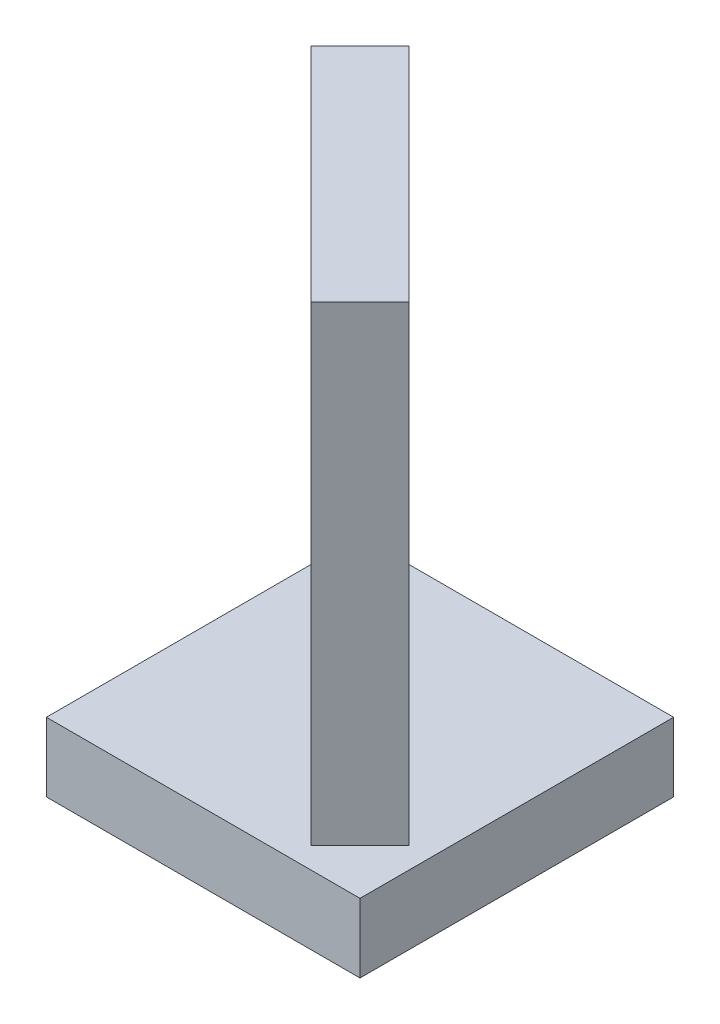
from build123d import *

# Parameters (mm, degrees)
SKETCH1_W           = 25.4
SKETCH1_H           = 25.4
BOSS_EXTRUDE1_DEPTH = 5.588
BOSS_EXTRUDE2_DEPTH = 38.1


with BuildPart() as part:
    # Sketch1 → Boss-Extrude1 (new body)
    with BuildSketch(Plane(origin=(0, 0, 0), x_dir=(1, 0, 0), z_dir=(0, 1, 0))):
        Rectangle(SKETCH1_W, SKETCH1_H)
    extrude(amount=BOSS_EXTRUDE1_DEPTH)

    # Sketch2 → Boss-Extrude2 (add)
    with BuildSketch(Plane(origin=(0, 5.588, 0), x_dir=(1, 0, 0), z_dir=(0, 1, 0))):
        Polygon((-7.004599774, 10.955912468), (10.955912468, -7.004599774), (7.004599774, -10.955912468), (-10.955912468, 7.004599774), align=None)
    extrude(amount=BOSS_EXTRUDE2_DEPTH)


solid = part.part
